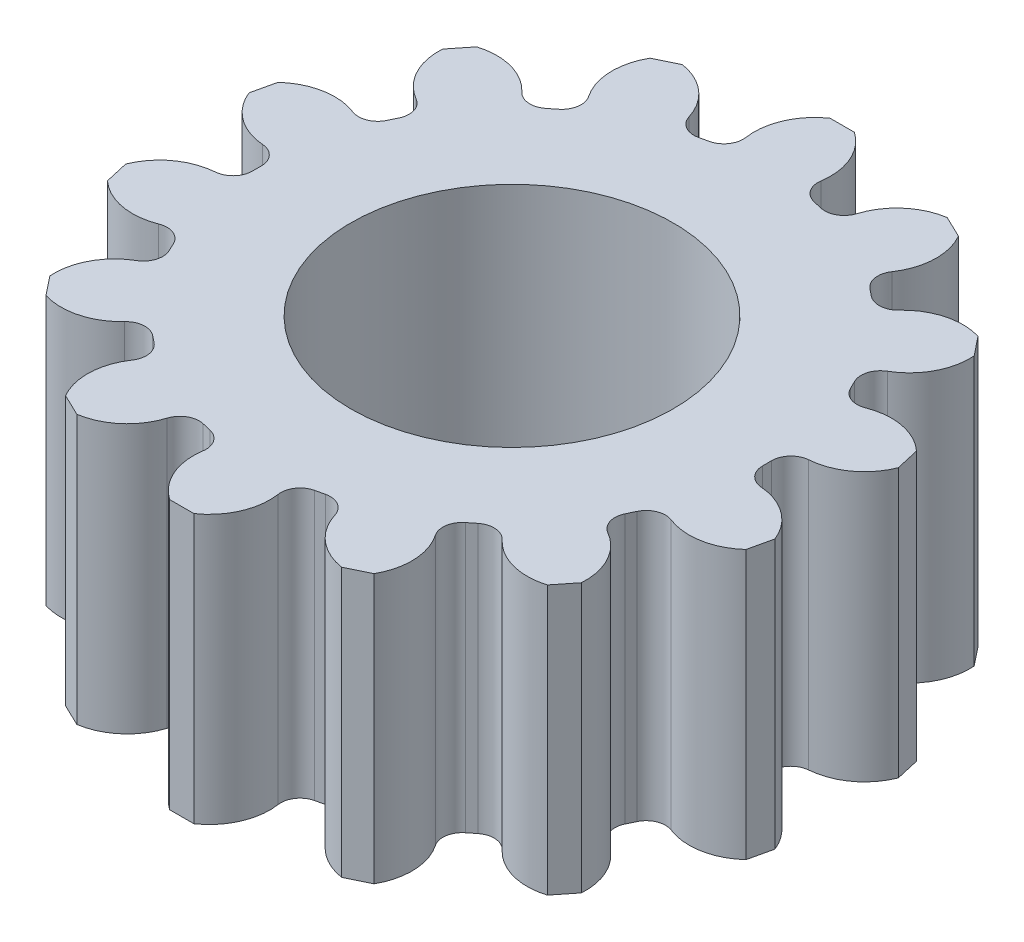
from build123d import *

# Parameters (mm, degrees)
SKETCH1_R           = 3
BOSS_EXTRUDE1_DEPTH = 5


with BuildPart() as part:
    # Sketch1 → Boss-Extrude1 (new body)
    with BuildSketch(Plane(origin=(0, 0, 0), x_dir=(1, 0, 0), z_dir=(0, 1, 0))):
        with BuildLine():
            Line((-0.225, 6.145882768), (0, 6.145882768))
            Line((0, 6.145882768), (0.225, 6.145882768))
            ThreePointArc((0.225, 6.145882768), (0.619244207, 5.666854432), (0.7, 5.051732376))
            ThreePointArc((0.7, 5.051732376), (0.758505487, 4.796373711), (0.975, 4.648857386))
            Line((0.975, 4.648857386), (1.138618979, 4.611512422))
            ThreePointArc((1.138618979, 4.611512422), (1.39767873, 4.650486589), (1.561186325, 4.855172217))
            ThreePointArc((1.561186325, 4.855172217), (1.900836238, 5.374339414), (2.4638806, 5.634872881))
            Line((2.4638806, 5.634872881), (2.666598596, 5.53724904))
            Line((2.666598596, 5.53724904), (2.869316591, 5.439625199))
            ThreePointArc((2.869316591, 5.439625199), (3.016675742, 4.83697943), (2.82254274, 4.247734982))
            ThreePointArc((2.82254274, 4.247734982), (2.76445839, 3.992280195), (2.895508272, 3.765439131))
            Line((2.895508272, 3.765439131), (3.026720505, 3.660800866))
            ThreePointArc((3.026720505, 3.660800866), (3.277035533, 3.583513564), (3.513160551, 3.696985656))
            ThreePointArc((3.513160551, 3.696985656), (4.044432754, 4.017370563), (4.66475943, 4.007807313))
            Line((4.66475943, 4.007807313), (4.805044636, 3.831895229))
            Line((4.805044636, 3.831895229), (4.945329841, 3.655983146))
            ThreePointArc((4.945329841, 3.655983146), (4.816617649, 3.049081331), (4.386046274, 2.602421581))
            ThreePointArc((4.386046274, 2.602421581), (4.222876405, 2.397466625), (4.242525619, 2.136229475))
            Line((4.242525619, 2.136229475), (4.315342915, 1.985022802))
            ThreePointArc((4.315342915, 1.985022802), (4.507335258, 1.806781729), (4.769310245, 1.806565745))
            ThreePointArc((4.769310245, 1.806565745), (5.386979761, 1.864712202), (5.941725446, 1.586946354))
            Line((5.941725446, 1.586946354), (5.991792656, 1.367587574))
            Line((5.991792656, 1.367587574), (6.041859866, 1.148228793))
            ThreePointArc((6.041859866, 1.148228793), (5.662569359, 0.657275279), (5.080839552, 0.441666668))
            ThreePointArc((5.080839552, 0.441666668), (4.844901957, 0.327805387), (4.749258736, 0.083913373))
            Line((4.749258736, 0.083913373), (4.749258736, -0.083913373))
            ThreePointArc((4.749258736, -0.083913373), (4.844901957, -0.327805387), (5.080839552, -0.441666668))
            ThreePointArc((5.080839552, -0.441666668), (5.662569359, -0.657275279), (6.041859866, -1.148228793))
            Line((6.041859866, -1.148228793), (5.991792656, -1.367587574))
            Line((5.991792656, -1.367587574), (5.941725446, -1.586946354))
            ThreePointArc((5.941725446, -1.586946354), (5.386979761, -1.864712202), (4.769310245, -1.806565745))
            ThreePointArc((4.769310245, -1.806565745), (4.507335258, -1.806781729), (4.315342915, -1.985022802))
            Line((4.315342915, -1.985022802), (4.242525619, -2.136229475))
            ThreePointArc((4.242525619, -2.136229475), (4.222876405, -2.397466625), (4.386046274, -2.602421581))
            ThreePointArc((4.386046274, -2.602421581), (4.816617649, -3.049081331), (4.945329841, -3.655983146))
            Line((4.945329841, -3.655983146), (4.805044636, -3.831895229))
            Line((4.805044636, -3.831895229), (4.66475943, -4.007807313))
            ThreePointArc((4.66475943, -4.007807313), (4.044432754, -4.017370563), (3.513160551, -3.696985656))
            ThreePointArc((3.513160551, -3.696985656), (3.277035533, -3.583513564), (3.026720505, -3.660800866))
            Line((3.026720505, -3.660800866), (2.895508272, -3.765439131))
            ThreePointArc((2.895508272, -3.765439131), (2.76445839, -3.992280195), (2.82254274, -4.247734982))
            ThreePointArc((2.82254274, -4.247734982), (3.016675742, -4.83697943), (2.869316591, -5.439625199))
            Line((2.869316591, -5.439625199), (2.666598596, -5.53724904))
            Line((2.666598596, -5.53724904), (2.4638806, -5.634872881))
            ThreePointArc((2.4638806, -5.634872881), (1.900836238, -5.374339414), (1.561186325, -4.855172217))
            ThreePointArc((1.561186325, -4.855172217), (1.39767873, -4.650486589), (1.138618979, -4.611512422))
            Line((1.138618979, -4.611512422), (0.975, -4.648857386))
            ThreePointArc((0.975, -4.648857386), (0.758505487, -4.796373711), (0.7, -5.051732376))
            ThreePointArc((0.7, -5.051732376), (0.619244207, -5.666854432), (0.225, -6.145882768))
            Line((0.225, -6.145882768), (0, -6.145882768))
            Line((0, -6.145882768), (-0.225, -6.145882768))
            ThreePointArc((-0.225, -6.145882768), (-0.619244207, -5.666854432), (-0.7, -5.051732376))
            ThreePointArc((-0.7, -5.051732376), (-0.758505487, -4.796373711), (-0.975, -4.648857386))
            Line((-0.975, -4.648857386), (-1.138618979, -4.611512422))
            ThreePointArc((-1.138618979, -4.611512422), (-1.39767873, -4.650486589), (-1.561186325, -4.855172217))
            ThreePointArc((-1.561186325, -4.855172217), (-1.900836238, -5.374339414), (-2.4638806, -5.634872881))
            Line((-2.4638806, -5.634872881), (-2.666598596, -5.53724904))
            Line((-2.666598596, -5.53724904), (-2.869316591, -5.439625199))
            ThreePointArc((-2.869316591, -5.439625199), (-3.016675742, -4.83697943), (-2.82254274, -4.247734982))
            ThreePointArc((-2.82254274, -4.247734982), (-2.76445839, -3.992280195), (-2.895508272, -3.765439131))
            Line((-2.895508272, -3.765439131), (-3.026720505, -3.660800866))
            ThreePointArc((-3.026720505, -3.660800866), (-3.277035533, -3.583513564), (-3.513160551, -3.696985656))
            ThreePointArc((-3.513160551, -3.696985656), (-4.044432754, -4.017370563), (-4.66475943, -4.007807313))
            Line((-4.66475943, -4.007807313), (-4.805044636, -3.831895229))
            Line((-4.805044636, -3.831895229), (-4.945329841, -3.655983146))
            ThreePointArc((-4.945329841, -3.655983146), (-4.816617649, -3.049081331), (-4.386046274, -2.602421581))
            ThreePointArc((-4.386046274, -2.602421581), (-4.222876405, -2.397466625), (-4.242525619, -2.136229475))
            Line((-4.242525619, -2.136229475), (-4.315342915, -1.985022802))
            ThreePointArc((-4.315342915, -1.985022802), (-4.507335258, -1.806781729), (-4.769310245, -1.806565745))
            ThreePointArc((-4.769310245, -1.806565745), (-5.386979761, -1.864712202), (-5.941725446, -1.586946354))
            Line((-5.941725446, -1.586946354), (-5.991792656, -1.367587574))
            Line((-5.991792656, -1.367587574), (-6.041859866, -1.148228793))
            ThreePointArc((-6.041859866, -1.148228793), (-5.662569359, -0.657275279), (-5.080839552, -0.441666668))
            ThreePointArc((-5.080839552, -0.441666668), (-4.844901957, -0.327805387), (-4.749258736, -0.083913373))
            Line((-4.749258736, -0.083913373), (-4.749258736, 0.083913373))
            ThreePointArc((-4.749258736, 0.083913373), (-4.844901957, 0.327805387), (-5.080839552, 0.441666668))
            ThreePointArc((-5.080839552, 0.441666668), (-5.662569359, 0.657275279), (-6.041859866, 1.148228793))
            Line((-6.041859866, 1.148228793), (-5.991792656, 1.367587574))
            Line((-5.991792656, 1.367587574), (-5.941725446, 1.586946354))
            ThreePointArc((-5.941725446, 1.586946354), (-5.386979761, 1.864712202), (-4.769310245, 1.806565745))
            ThreePointArc((-4.769310245, 1.806565745), (-4.507335258, 1.806781729), (-4.315342915, 1.985022802))
            Line((-4.315342915, 1.985022802), (-4.242525619, 2.136229475))
            ThreePointArc((-4.242525619, 2.136229475), (-4.222876405, 2.397466625), (-4.386046274, 2.602421581))
            ThreePointArc((-4.386046274, 2.602421581), (-4.816617649, 3.049081331), (-4.945329841, 3.655983146))
            Line((-4.945329841, 3.655983146), (-4.805044636, 3.831895229))
            Line((-4.805044636, 3.831895229), (-4.66475943, 4.007807313))
            ThreePointArc((-4.66475943, 4.007807313), (-4.044432754, 4.017370563), (-3.513160551, 3.696985656))
            ThreePointArc((-3.513160551, 3.696985656), (-3.277035533, 3.583513564), (-3.026720505, 3.660800866))
            Line((-3.026720505, 3.660800866), (-2.895508272, 3.765439131))
            ThreePointArc((-2.895508272, 3.765439131), (-2.76445839, 3.992280195), (-2.82254274, 4.247734982))
            ThreePointArc((-2.82254274, 4.247734982), (-3.016675742, 4.83697943), (-2.869316591, 5.439625199))
            Line((-2.869316591, 5.439625199), (-2.666598596, 5.53724904))
            Line((-2.666598596, 5.53724904), (-2.4638806, 5.634872881))
            ThreePointArc((-2.4638806, 5.634872881), (-1.900836238, 5.374339414), (-1.561186325, 4.855172217))
            ThreePointArc((-1.561186325, 4.855172217), (-1.39767873, 4.650486589), (-1.138618979, 4.611512422))
            Line((-1.138618979, 4.611512422), (-0.975, 4.648857386))
            ThreePointArc((-0.975, 4.648857386), (-0.758505487, 4.796373711), (-0.7, 5.051732376))
            ThreePointArc((-0.7, 5.051732376), (-0.619244207, 5.666854432), (-0.225, 6.145882768))
        make_face()
        with Locations(Location((0, 0, 0), (0, 0, 270))):
            Circle(SKETCH1_R, mode=Mode.SUBTRACT)
    extrude(amount=BOSS_EXTRUDE1_DEPTH)


solid = part.part
